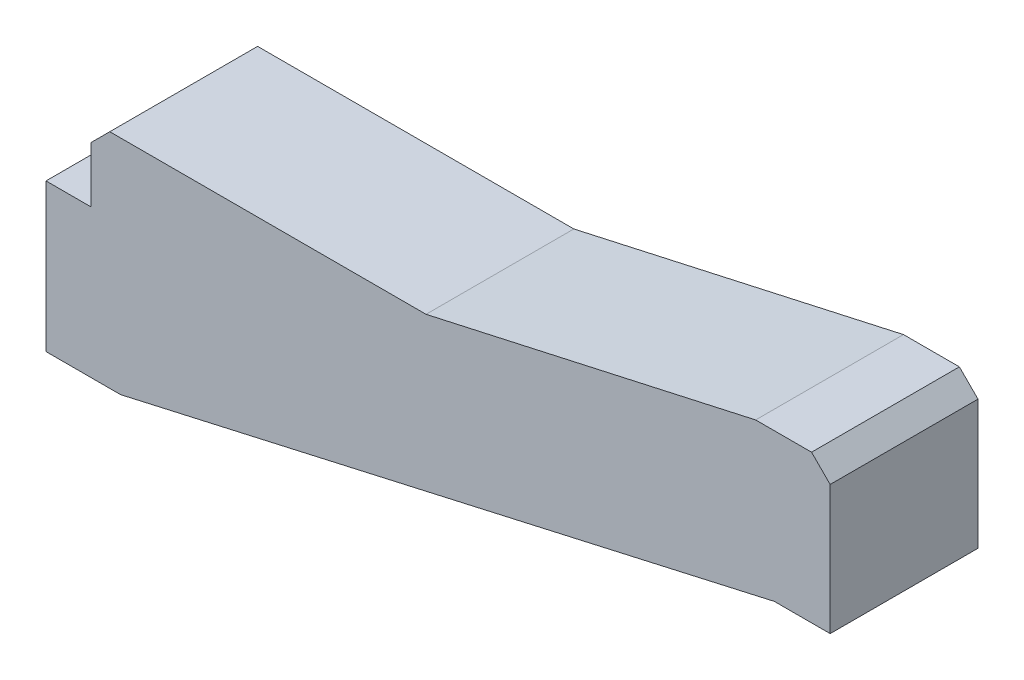
from build123d import *

# Parameters (mm, degrees)
BOSS_EXTRUDE1_DEPTH = 1.984375
CHAMFER1_SIZE       = 0.25


with BuildPart() as part:
    # Sketch1 → Boss-Extrude1 (new body)
    with BuildSketch(Plane.XY):
        Polygon((0, 0), (1, 0), (1, -1.984375), (0.25, -1.984375), (-8.526125475, -3.96875), (-9.526125475, -3.96875), (-9.526125475, -1.984375), (-8.92, -1.984375), (-8.92, -0.984375), (-4.42488189, -0.984375), align=None)
    extrude(amount=BOSS_EXTRUDE1_DEPTH)

    # Chamfer1
    chamfer1_edges = [part.edges().sort_by_distance(p)[0] for p in [
        (1, 0, 0.9921875),
        (-8.92, -0.984375, 0.9921875),
    ]]
    chamfer(chamfer1_edges, length=CHAMFER1_SIZE)


solid = part.part
